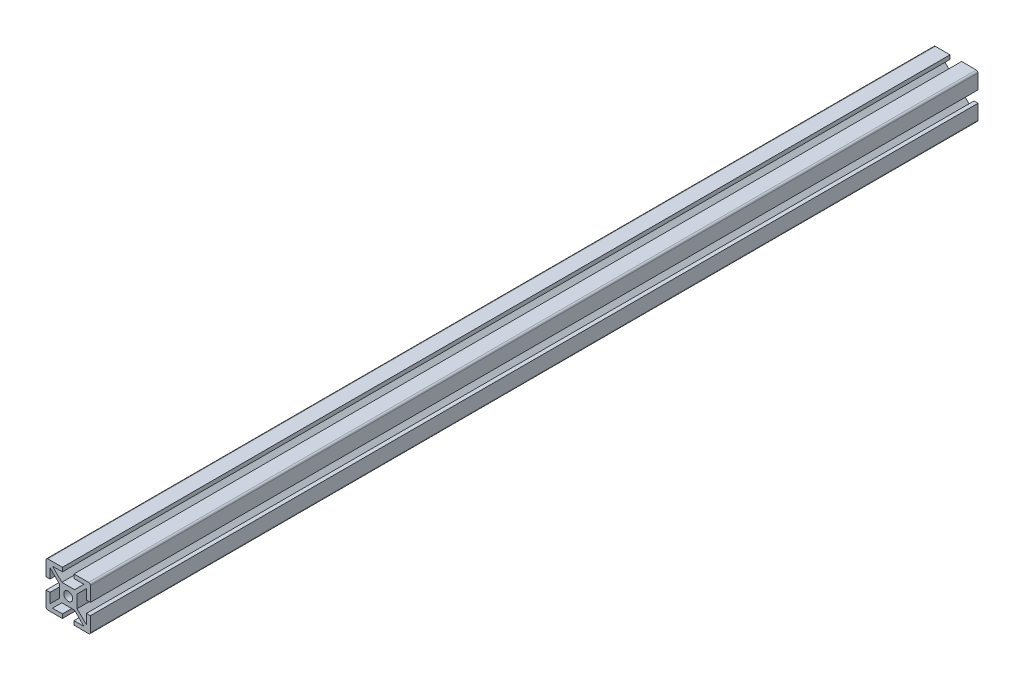
from build123d import *

# Parameters (mm, degrees)
SKETCH1_R           = 2.5
BOSS_EXTRUDE1_DEPTH = 500
FILLET1_R           = 1


with BuildPart() as part:
    # Sketch1 → Boss-Extrude1 (new body)
    with BuildSketch(Plane.XY):
        Polygon((-12.5, 12.5), (-12.5, 3.25), (-10.25, 3.25), (-10.25, 8.835786438), (-5, 3.585786438), (-5, -3.585786438), (-10.25, -8.835786438), (-10.25, -3.25), (-12.5, -3.25), (-12.5, -12.5), (-3.25, -12.5), (-3.25, -10.25), (-8.835786438, -10.25), (-3.585786438, -5), (3.585786438, -5), (8.835786438, -10.25), (3.25, -10.25), (3.25, -12.5), (12.5, -12.5), (12.5, -3.25), (10.25, -3.25), (10.25, -8.835786438), (5, -3.585786438), (5, 3.585786438), (10.25, 8.835786438), (10.25, 3.25), (12.5, 3.25), (12.5, 12.5), (3.25, 12.5), (3.25, 10.25), (8.835786438, 10.25), (3.585786438, 5), (-3.585786438, 5), (-8.835786438, 10.25), (-3.25, 10.25), (-3.25, 12.5), align=None)
        Circle(SKETCH1_R, mode=Mode.SUBTRACT)
    extrude(amount=BOSS_EXTRUDE1_DEPTH)

    # Fillet1
    fillet1_edges = [part.edges().sort_by_distance(p)[0] for p in [
        (12.5, 12.5, 250),
        (12.5, -12.5, 250),
        (-12.5, -12.5, 250),
        (-12.5, 12.5, 250),
    ]]
    fillet(fillet1_edges, radius=FILLET1_R)


solid = part.part
